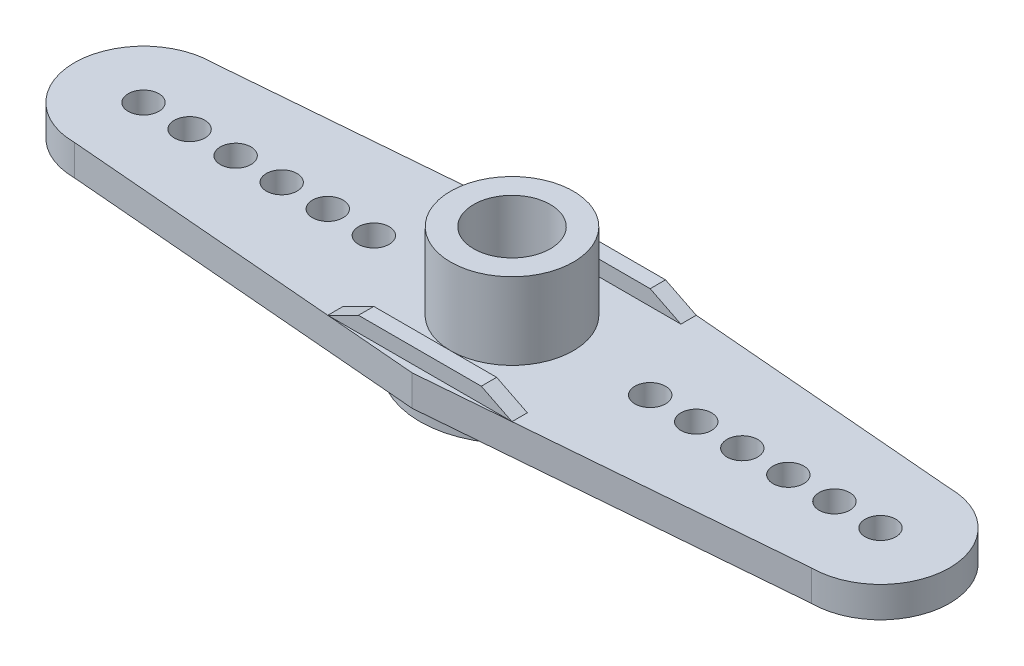
from build123d import *

# Parameters (mm, degrees)
SKETCH1_R           = 1
SKETCH1_R_2         = 1.5
BOSS_EXTRUDE1_DEPTH = 2
SKETCH2_R           = 4
SKETCH2_R_2         = 2.5
BOSS_EXTRUDE2_DEPTH = 5
BOSS_EXTRUDE3_START = 1
SKETCH3_R           = 6
SKETCH3_R_2         = 4
BOSS_EXTRUDE3_DEPTH = 1
SKETCH4_R           = 3.5
CUT_EXTRUDE1_DEPTH  = 1
SKETCH5_W           = 12
SKETCH5_H           = 1
BOSS_EXTRUDE4_DEPTH = 1
CUT_EXTRUDE2_DEPTH  = 20


with BuildPart() as part:
    # Sketch1 → Boss-Extrude1 (new body)
    # profile 1 of 3: a face of its own
    with BuildSketch(Plane(origin=(0, 0, 0), x_dir=(1, 0, 0), z_dir=(0, 1, 0))):
        with BuildLine():
            Line((-1.075862069, 6.410344828), (-24, 4.5))
            ThreePointArc((-24, 4.5), (-28.5, 0), (-24, -4.5))
            Line((-24, -4.5), (-1.075862069, -6.410344828))
            ThreePointArc((-1.075862069, -6.410344828), (-6.5, 0), (-1.075862069, 6.410344828))
        make_face()
        with Locations(Location((-21, 0, 0), (0, 0, 270))):
            Circle(SKETCH1_R, mode=Mode.SUBTRACT)
        with Locations(Location((-18, 0, 0), (0, 0, 270))):
            Circle(SKETCH1_R, mode=Mode.SUBTRACT)
        with Locations(Location((-15, 0, 0), (0, 0, 270))):
            Circle(SKETCH1_R, mode=Mode.SUBTRACT)
        with Locations(Location((-12, 0, 0), (0, 0, 270))):
            Circle(SKETCH1_R, mode=Mode.SUBTRACT)
        with Locations(Location((-9, 0, 0), (0, 0, 270))):
            Circle(SKETCH1_R, mode=Mode.SUBTRACT)
        with Locations(Location((-24, 0, 0), (0, 0, 270))):
            Circle(SKETCH1_R, mode=Mode.SUBTRACT)
    # profile 2 of 3: a face of its own
    with BuildSketch(Plane(origin=(0, 0, 0), x_dir=(1, 0, 0), z_dir=(0, 1, 0))):
        with BuildLine():
            Line((0, 6.5), (-1.075862069, 6.410344828))
            ThreePointArc((-1.075862069, 6.410344828), (-6.5, 0), (-1.075862069, -6.410344828))
            Line((-1.075862069, -6.410344828), (0, -6.5))
            Line((0, -6.5), (1.075862069, -6.410344828))
            ThreePointArc((1.075862069, -6.410344828), (4.962010855, -4.19862457), (6.5, 0))
            ThreePointArc((6.5, 0), (4.962010855, 4.19862457), (1.075862069, 6.410344828))
            Line((1.075862069, 6.410344828), (0, 6.5))
        make_face()
        with Locations(Location((0, 0, 0), (0, 0, 270))):
            Circle(SKETCH1_R_2, mode=Mode.SUBTRACT)
    # profile 3 of 3: a face of its own
    with BuildSketch(Plane(origin=(0, 0, 0), x_dir=(1, 0, 0), z_dir=(0, 1, 0))):
        with BuildLine():
            Line((24, 4.5), (1.075862069, 6.410344828))
            ThreePointArc((1.075862069, 6.410344828), (4.962010855, 4.19862457), (6.5, 0))
            ThreePointArc((6.5, 0), (4.962010855, -4.19862457), (1.075862069, -6.410344828))
            Line((1.075862069, -6.410344828), (24, -4.5))
            ThreePointArc((24, -4.5), (28.5, 0), (24, 4.5))
        make_face()
        with Locations(Location((9, 0, 0), (0, 0, 270))):
            Circle(SKETCH1_R, mode=Mode.SUBTRACT)
        with Locations(Location((12, 0, 0), (0, 0, 270))):
            Circle(SKETCH1_R, mode=Mode.SUBTRACT)
        with Locations(Location((15, 0, 0), (0, 0, 270))):
            Circle(SKETCH1_R, mode=Mode.SUBTRACT)
        with Locations(Location((18, 0, 0), (0, 0, 270))):
            Circle(SKETCH1_R, mode=Mode.SUBTRACT)
        with Locations(Location((21, 0, 0), (0, 0, 270))):
            Circle(SKETCH1_R, mode=Mode.SUBTRACT)
        with Locations(Location((24, 0, 0), (0, 0, 270))):
            Circle(SKETCH1_R, mode=Mode.SUBTRACT)
    extrude(amount=BOSS_EXTRUDE1_DEPTH)

    # Sketch2 → Boss-Extrude2 (add)
    with BuildSketch(Plane(origin=(0, 2, 0), x_dir=(1, 0, 0), z_dir=(0, 1, 0))):
        with Locations(Location((0, 0, 0), (0, 0, 270))):
            Circle(SKETCH2_R)
        with Locations(Location((0, 0, 0), (0, 0, 270))):
            Circle(SKETCH2_R_2, mode=Mode.SUBTRACT)
    extrude(amount=BOSS_EXTRUDE2_DEPTH)

    # Sketch3 → Boss-Extrude3 (add)
    with BuildSketch(Plane.XZ.offset(BOSS_EXTRUDE3_START)):
        with Locations(Location((0, 0, 0), (0, 0, 90))):
            Circle(SKETCH3_R)
        with Locations(Location((0, 0, 0), (0, 0, 90))):
            Circle(SKETCH3_R_2, mode=Mode.SUBTRACT)
    extrude(amount=-BOSS_EXTRUDE3_DEPTH)

    # Sketch4 → Cut-Extrude1 (cut)
    with BuildSketch(Plane.XZ):
        with Locations(Location((0, 0, 0), (0, 0, 270))):
            Circle(SKETCH4_R)
    extrude(amount=-CUT_EXTRUDE1_DEPTH, mode=Mode.SUBTRACT)

    # Sketch5 → Boss-Extrude4 (add)
    with BuildSketch(Plane(origin=(0, 2, 0), x_dir=(1, 0, 0), z_dir=(0, 1, 0))):
        with Locations((0, 5.5)):
            Rectangle(SKETCH5_W, SKETCH5_H)
        with Locations((0, -5.5)):
            Rectangle(SKETCH5_W, SKETCH5_H)
    extrude(amount=BOSS_EXTRUDE4_DEPTH)

    # Sketch6 → Cut-Extrude2 (cut)
    with BuildSketch(Plane.XY.offset(6)):
        Polygon((-4, 3), (-6, 2), (-6, 3), align=None)
        Polygon((6, 2), (4, 3), (6, 3), align=None)
    extrude(amount=-CUT_EXTRUDE2_DEPTH, mode=Mode.SUBTRACT)


solid = part.part
